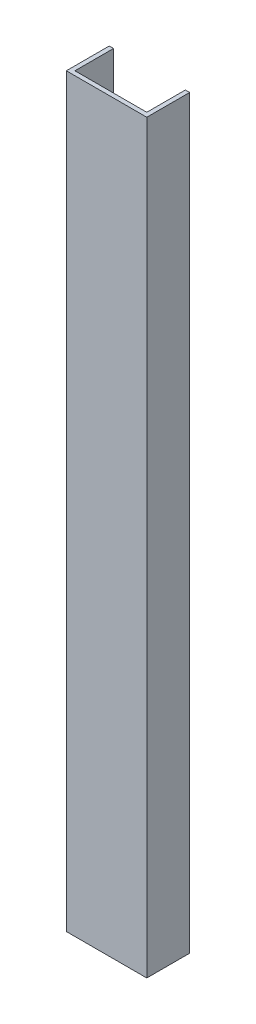
from build123d import *

# Parameters (mm, degrees)
SKETCH_1_W      = 75
SKETCH_1_H      = 695
EXTRUDE_1_DEPTH = 4
SKETCH_2_W      = 4
SKETCH_2_H      = 695
EXTRUDE_2_DEPTH = 36


with BuildPart() as part:
    # 스케치1 → 보스-돌출1 (new body)
    with BuildSketch(Plane.XY):
        with Locations((37.5, 347.5)):
            Rectangle(SKETCH_1_W, SKETCH_1_H)
    extrude(amount=EXTRUDE_1_DEPTH)

    # 스케치2 → 보스-돌출2 (add)
    with BuildSketch(Plane(origin=(0, 0, 0), x_dir=(-1, 0, 0), z_dir=(0, 0, -1))):
        with Locations((-73, 347.5)):
            Rectangle(SKETCH_2_W, SKETCH_2_H)
        with Locations((-2, 347.5)):
            Rectangle(SKETCH_2_W, SKETCH_2_H)
    extrude(amount=EXTRUDE_2_DEPTH)


solid = part.part
